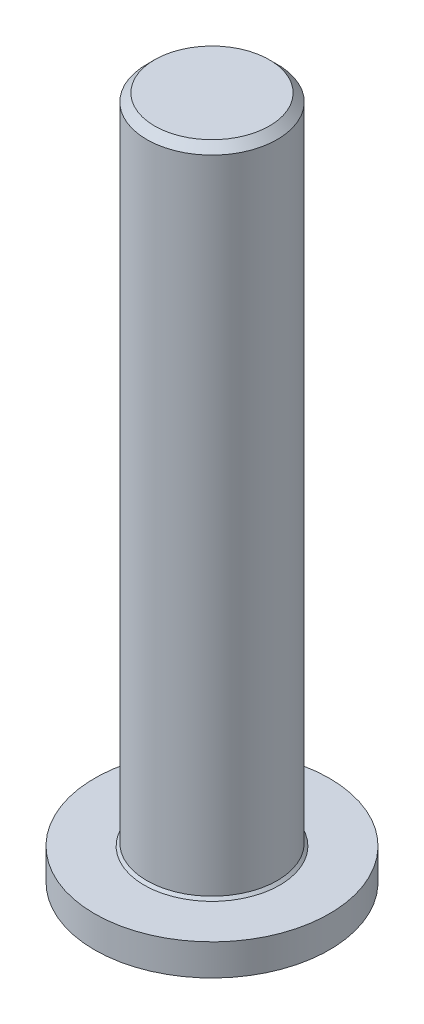
from build123d import *

# Parameters (mm, degrees)
SKETCH2_R           = 4.5
BOSS_EXTRUDE1_DEPTH = 1.5
SKETCH3_R           = 2.5
BOSS_EXTRUDE2_DEPTH = 25
CHAMFER1_SIZE       = 0.1
CHAMFER2_SIZE       = 0.75
CHAMFER2_SIZE2      = 0.3
CUT_EXTRUDE1_DEPTH  = 3
CHAMFER3_SIZE       = 0.3


with BuildPart() as part:
    # Sketch2 → Boss-Extrude1 (new body)
    with BuildSketch(Plane(origin=(0, 0, 0), x_dir=(1, 0, 0), z_dir=(0, 1, 0))):
        Circle(SKETCH2_R)
    extrude(amount=BOSS_EXTRUDE1_DEPTH)

    # Sketch3 → Boss-Extrude2 (add)
    with BuildSketch(Plane(origin=(0, 1.5, 0), x_dir=(1, 0, 0), z_dir=(0, 1, 0))):
        Circle(SKETCH3_R)
    extrude(amount=BOSS_EXTRUDE2_DEPTH)

    # Chamfer1
    chamfer1_edges = [part.edges().sort_by_distance(p)[0] for p in [
        (-2.5, 1.5, 0),
    ]]
    chamfer(chamfer1_edges, length=CHAMFER1_SIZE)

    # Chamfer2
    chamfer2_edges = [part.edges().sort_by_distance(p)[0] for p in [
        (-4.5, 0, 0),
    ]]
    chamfer2_side = [part.faces().sort_by_distance(p)[0] for p in [
        (0, 0, 0),
    ]]
    chamfer(chamfer2_edges, length=CHAMFER2_SIZE, length2=CHAMFER2_SIZE2, reference=chamfer2_side[0])

    # Sketch4 → Cut-Extrude1 (cut)
    with BuildSketch(Plane.XZ):
        Polygon((-0.422737578, 1.679670486), (-1.6660061, 0.473733761), (-1.243268521, -1.205936725), (0.422737578, -1.679670486), (1.6660061, -0.473733761), (1.243268521, 1.205936725), align=None)
    extrude(amount=-CUT_EXTRUDE1_DEPTH, mode=Mode.SUBTRACT)

    # Chamfer3
    chamfer3_edges = [part.edges().sort_by_distance(p)[0] for p in [
        (-2.5, 26.5, 0),
    ]]
    chamfer(chamfer3_edges, length=CHAMFER3_SIZE)


solid = part.part
